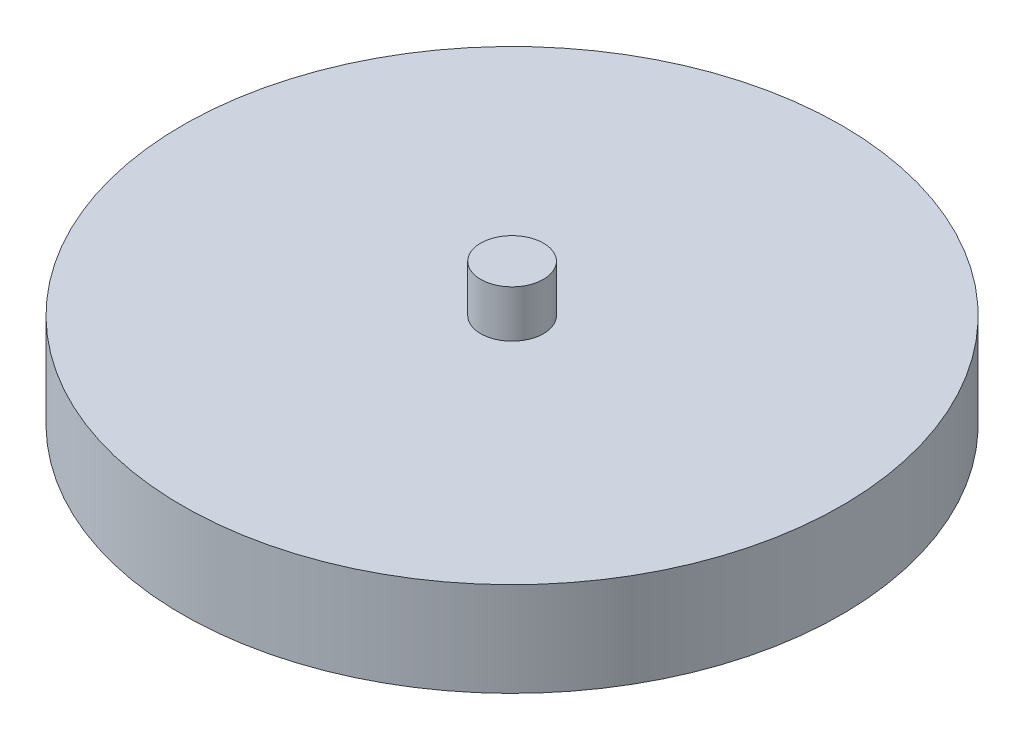
from build123d import *


with BuildPart() as part:
    # Sketch1 → Revolve1 (revolve)
    with BuildSketch(Plane.XY, mode=Mode.PRIVATE) as revolve1_sk:
        Polygon((-10, 0), (-105, 0), (-105, -30), (0, -30), (0, 15), (-10, 15), align=None)
    revolve(revolve1_sk.sketch.rotate(Axis((0, 0, 0), (0, 1, 0)), 270), axis=Axis((0, 0, 0), (0, 1, 0)))


solid = part.part
